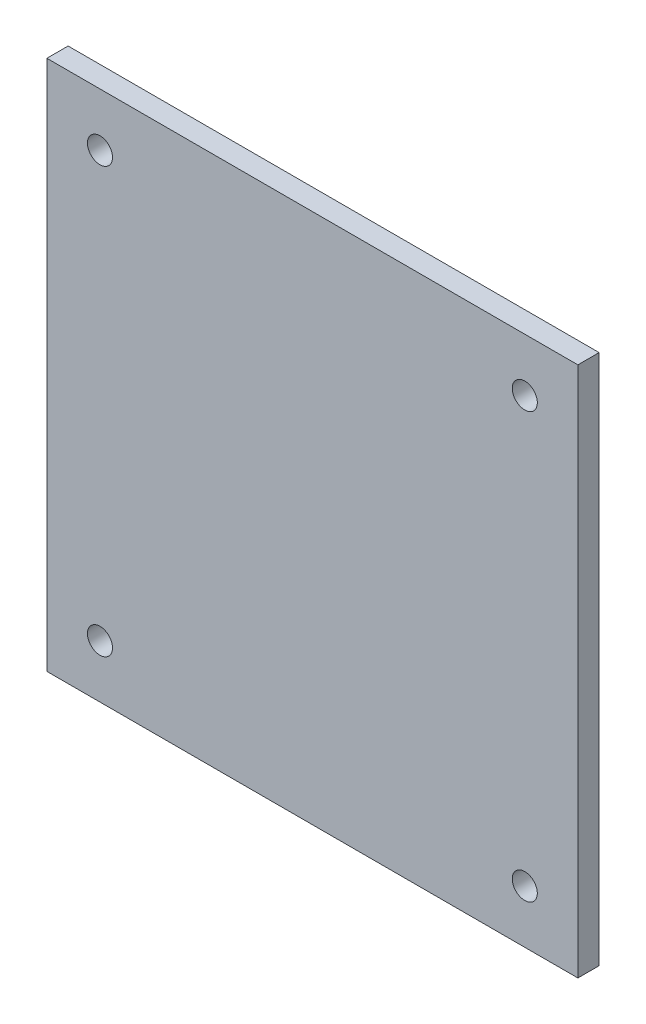
from build123d import *

# Parameters (mm, degrees)
SKETCH1_W            = 63.5
SKETCH1_H            = 63.5
BOSS_EXTRUDE1_DEPTH  = 2.54
SKETCH2_R            = 1.5
CUT_EXTRUDE1_DEPTH   = 2.54
LPATTERN1_COUNT      = 2
LPATTERN1_PITCH      = 50.8
LPATTERN1_COUNT_DIR2 = 2
LPATTERN1_PITCH_DIR2 = 50.8


with BuildPart() as part:
    # Sketch1 → Boss-Extrude1 (new body)
    with BuildSketch(Plane.XY):
        with Locations((31.75, 31.75)):
            Rectangle(SKETCH1_W, SKETCH1_H)
    extrude(amount=BOSS_EXTRUDE1_DEPTH)

    # Sketch2 → Cut-Extrude1 (cut)
    with BuildSketch(Plane.XY.offset(2.54)):
        with Locations((6.35, 57.15)):
            Circle(SKETCH2_R)
    cut_extrude1 = extrude(amount=-CUT_EXTRUDE1_DEPTH, mode=Mode.SUBTRACT)

    # LPattern1: Cut-Extrude1 2 × 2
    with Locations(*[(i * LPATTERN1_PITCH, -j * LPATTERN1_PITCH_DIR2, 0) for i in range(LPATTERN1_COUNT) for j in range(LPATTERN1_COUNT_DIR2) if (i, j) != (0, 0)]):
        add(cut_extrude1, mode=Mode.SUBTRACT)


solid = part.part
